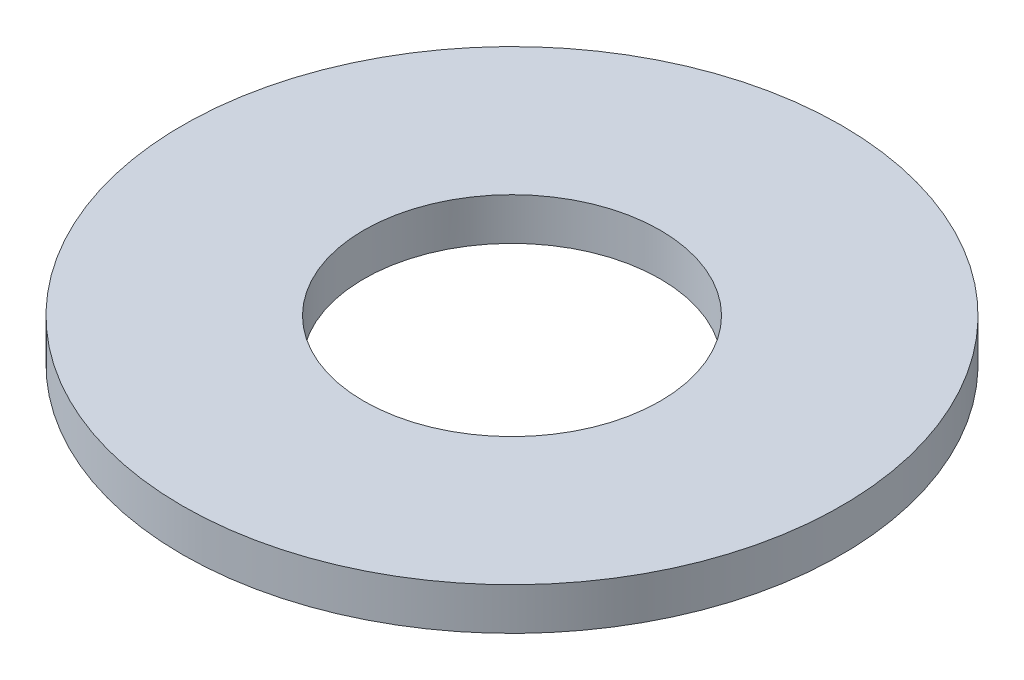
from build123d import *

# Parameters (mm, degrees)
SKETCH1_R           = 15.875
BOSS_EXTRUDE2_DEPTH = 2.032
SKETCH3_R           = 7.1374
CUT_EXTRUDE1_DEPTH  = 3.302


with BuildPart() as part:
    # Sketch1 → Boss-Extrude2 (new body)
    with BuildSketch(Plane(origin=(0, 0, 0), x_dir=(1, 0, 0), z_dir=(0, 1, 0))):
        with Locations(Location((0, 0, 0), (0, 0, 270))):
            Circle(SKETCH1_R)
    extrude(amount=BOSS_EXTRUDE2_DEPTH)

    # Sketch3 → Cut-Extrude1 (cut)
    with BuildSketch(Plane(origin=(0, 0, 0), x_dir=(-1, 0, 0), z_dir=(0, -1, 0))):
        with Locations(Location((0, 0, 0), (0, 0, 90))):
            Circle(SKETCH3_R)
    extrude(amount=-CUT_EXTRUDE1_DEPTH, mode=Mode.SUBTRACT)


solid = part.part
